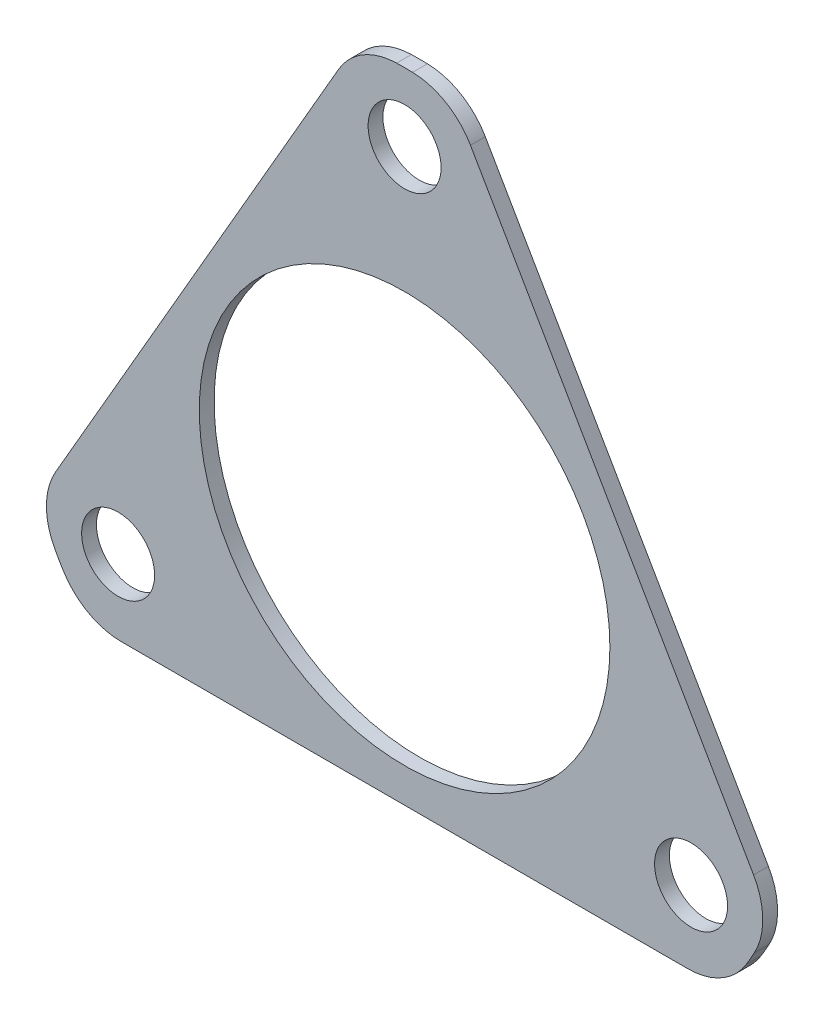
from build123d import *

# Parameters (mm, degrees)
SKETCH2_R           = 18
BOSS_EXTRUDE1_DEPTH = 1.3
BOSS_EXTRUDE7_START = -1.3
BOSS_EXTRUDE7_DEPTH = 1.3
SKETCH17_R          = 0.7
BOSS_EXTRUDE9_DEPTH = 1.3
BOSS_EXTRUDE2_START = -1.3
SKETCH3_R           = 35
SKETCH3_R_2         = 18
BOSS_EXTRUDE2_DEPTH = 1.3
SKETCH6_R           = 5
BOSS_EXTRUDE4_DEPTH = 1
SKETCH7_R           = 59.131365533
CUT_EXTRUDE1_DEPTH  = 10
FILLET1_R           = 6
SKETCH4_R           = 3.2
CUT_EXTRUDE2_DEPTH  = 10
SKETCH18_R          = 18
CUT_EXTRUDE3_DEPTH  = 10


with BuildPart() as part:
    # Sketch2 → Boss-Extrude1 (new body)
    with BuildSketch(Plane.XY.offset(10)):
        Circle(SKETCH2_R)
        with BuildLine():
            ThreePointArc((0, 0.538550206), (0.166421166, 0.512191682), (0.316551869, 0.435696269))
            Line((0.316551869, 0.435696269), (9.992349289, 13.753288904))
            ThreePointArc((9.992349289, 13.753288904), (13.753288904, 9.992349289), (16.167960777, 5.253288904))
            Line((16.167960777, 5.253288904), (0.512191682, 0.166421166))
            ThreePointArc((0.512191682, 0.166421166), (0.538550206, 0), (0.512191682, -0.166421166))
            Line((0.512191682, -0.166421166), (16.167960777, -5.253288904))
            ThreePointArc((16.167960777, -5.253288904), (13.753288904, -9.992349289), (9.992349289, -13.753288904))
            Line((9.992349289, -13.753288904), (0.316551869, -0.435696269))
            ThreePointArc((0.316551869, -0.435696269), (0.166421166, -0.512191682), (0, -0.538550206))
            Line((0, -0.538550206), (0, -17))
            ThreePointArc((0, -17), (-5.253288904, -16.167960777), (-9.992349289, -13.753288904))
            Line((-9.992349289, -13.753288904), (-0.316551869, -0.435696269))
            ThreePointArc((-0.316551869, -0.435696269), (-0.435696269, -0.316551869), (-0.512191682, -0.166421166))
            Line((-0.512191682, -0.166421166), (-16.167960777, -5.253288904))
            ThreePointArc((-16.167960777, -5.253288904), (-17, 0), (-16.167960777, 5.253288904))
            Line((-16.167960777, 5.253288904), (-0.512191682, 0.166421166))
            ThreePointArc((-0.512191682, 0.166421166), (-0.435696269, 0.316551869), (-0.316551869, 0.435696269))
            Line((-0.316551869, 0.435696269), (-9.992349289, 13.753288904))
            ThreePointArc((-9.992349289, 13.753288904), (-5.253288904, 16.167960777), (0, 17))
            Line((0, 17), (0, 0.538550206))
        make_face(mode=Mode.SUBTRACT)
        with BuildLine():
            Line((0.5, 1.198581445), (0.5, 16.492422502))
            ThreePointArc((0.5, 16.492422502), (5.193820321, 15.661233364), (9.454148381, 13.522909391))
            Line((9.454148381, 13.522909391), (0.5, 1.198581445))
        make_face(mode=Mode.SUBTRACT)
        with BuildLine():
            Line((-9.939558578, 13.170238239), (-0.985410197, 0.845910294))
            Line((-0.985410197, 0.845910294), (-15.530717393, 5.57196709))
            ThreePointArc((-15.530717393, 5.57196709), (-13.289739299, 9.779203923), (-9.939558578, 13.170238239))
        make_face(mode=Mode.SUBTRACT)
        with BuildLine():
            Line((-15.597133416, -5.383254519), (-1.109016994, -0.675780132))
            Line((-1.109016994, -0.675780132), (-10.098511219, -13.048757457))
            ThreePointArc((-10.098511219, -13.048757457), (-13.40733091, -9.617352956), (-15.597133416, -5.383254519))
        make_face(mode=Mode.SUBTRACT)
        with BuildLine():
            ThreePointArc((9.289494224, -13.636542709), (5.003553098, -15.723054932), (0.3, -16.497272502))
            Line((0.3, -16.497272502), (0.3, -1.263565384))
            Line((0.3, -1.263565384), (9.289494224, -13.636542709))
        make_face(mode=Mode.SUBTRACT)
        with BuildLine():
            Line((15.782543612, -4.812620609), (1.294427191, -0.105146222))
            Line((1.294427191, -0.105146222), (15.839734388, 4.620910574))
            ThreePointArc((15.839734388, 4.620910574), (16.499696789, -0.100029399), (15.782543612, -4.812620609))
        make_face(mode=Mode.SUBTRACT)
    extrude(amount=-BOSS_EXTRUDE1_DEPTH)

    # Sketch11 → Boss-Extrude7 (add)
    with BuildSketch(Plane(origin=(0, 0, 8.7), x_dir=(-1, 0, 0), z_dir=(0, 0, -1)).offset(BOSS_EXTRUDE7_START)):
        with BuildLine():
            ThreePointArc((-0.512191682, 0.166421166), (-0.435696269, 0.316551869), (-0.316551869, 0.435696269))
            Line((-0.316551869, 0.435696269), (-9.992349289, 13.753288904))
            ThreePointArc((-9.992349289, 13.753288904), (-13.753288904, 9.992349289), (-16.167960777, 5.253288904))
            Line((-16.167960777, 5.253288904), (-0.512191682, 0.166421166))
        make_face()
        with BuildLine():
            Line((0, 17), (0, 0.538550206))
            ThreePointArc((0, 0.538550206), (0.166421166, 0.512191682), (0.316551869, 0.435696269))
            Line((0.316551869, 0.435696269), (9.992349289, 13.753288904))
            ThreePointArc((9.992349289, 13.753288904), (5.253288904, 16.167960777), (0, 17))
        make_face()
        with BuildLine():
            Line((16.167960777, 5.253288904), (0.512191682, 0.166421166))
            ThreePointArc((0.512191682, 0.166421166), (0.531919759, 0.084247813), (0.538550206, 0))
            ThreePointArc((0.538550206, 0), (0.531919759, -0.084247813), (0.512191682, -0.166421166))
            Line((0.512191682, -0.166421166), (16.167960777, -5.253288904))
            ThreePointArc((16.167960777, -5.253288904), (17, 0), (16.167960777, 5.253288904))
        make_face()
        with BuildLine():
            Line((9.992349289, -13.753288904), (0.316551869, -0.435696269))
            ThreePointArc((0.316551869, -0.435696269), (0.166421166, -0.512191682), (0, -0.538550206))
            Line((0, -0.538550206), (0, -17))
            ThreePointArc((0, -17), (5.253288904, -16.167960777), (9.992349289, -13.753288904))
        make_face()
        with BuildLine():
            ThreePointArc((-0.316551869, -0.435696269), (-0.435696269, -0.316551869), (-0.512191682, -0.166421166))
            Line((-0.512191682, -0.166421166), (-16.167960777, -5.253288904))
            ThreePointArc((-16.167960777, -5.253288904), (-13.753288904, -9.992349289), (-9.992349289, -13.753288904))
            Line((-9.992349289, -13.753288904), (-0.316551869, -0.435696269))
        make_face()
        with BuildLine():
            ThreePointArc((0.316551869, 0.435696269), (0.166421166, 0.512191682), (0, 0.538550206))
            ThreePointArc((0, 0.538550206), (-0.166421166, 0.512191682), (-0.316551869, 0.435696269))
            ThreePointArc((-0.316551869, 0.435696269), (-0.435696269, 0.316551869), (-0.512191682, 0.166421166))
            ThreePointArc((-0.512191682, 0.166421166), (-0.538550206, 0), (-0.512191682, -0.166421166))
            ThreePointArc((-0.512191682, -0.166421166), (-0.435696269, -0.316551869), (-0.316551869, -0.435696269))
            ThreePointArc((-0.316551869, -0.435696269), (-0.166421166, -0.512191682), (0, -0.538550206))
            ThreePointArc((0, -0.538550206), (0.166421166, -0.512191682), (0.316551869, -0.435696269))
            ThreePointArc((0.316551869, -0.435696269), (0.435696269, -0.316551869), (0.512191682, -0.166421166))
            ThreePointArc((0.512191682, -0.166421166), (0.531919759, -0.084247813), (0.538550206, 0))
            ThreePointArc((0.538550206, 0), (0.531919759, 0.084247813), (0.512191682, 0.166421166))
            ThreePointArc((0.512191682, 0.166421166), (0.435696269, 0.316551869), (0.316551869, 0.435696269))
        make_face()
    extrude(amount=BOSS_EXTRUDE7_DEPTH)

    # Sketch17 → Boss-Extrude9 (add)
    with BuildSketch(Plane(origin=(0, 0, 8.7), x_dir=(-1, 0, 0), z_dir=(0, 0, -1))):
        Circle(SKETCH17_R)
    extrude(amount=-BOSS_EXTRUDE9_DEPTH)

    # Sketch3 → Boss-Extrude2 (add)
    with BuildSketch(Plane(origin=(0, 0, 8.7), x_dir=(-1, 0, 0), z_dir=(0, 0, -1)).offset(BOSS_EXTRUDE2_START)):
        Circle(SKETCH3_R)
        Circle(SKETCH3_R_2, mode=Mode.SUBTRACT)
    extrude(amount=BOSS_EXTRUDE2_DEPTH)

    # Sketch6 → Boss-Extrude4 (add)
    with BuildSketch(Plane(origin=(0, 0, 10), x_dir=(-1, 0, 0), z_dir=(0, 0, -1))):
        with Locations((0, 30)):
            Circle(SKETCH6_R)
        with Locations((25.980762114, -15)):
            Circle(SKETCH6_R)
        with Locations((-25.980762114, -15)):
            Circle(SKETCH6_R)
    extrude(amount=BOSS_EXTRUDE4_DEPTH)

    # Sketch7 → Cut-Extrude1 (cut)
    with BuildSketch(Plane(origin=(0, 0, 8.7), x_dir=(-1, 0, 0), z_dir=(0, 0, -1))):
        Circle(SKETCH7_R)
        Polygon((0, 42), (-36.373066959, -21), (36.373066959, -21), align=None, mode=Mode.SUBTRACT)
    extrude(amount=-CUT_EXTRUDE1_DEPTH, mode=Mode.SUBTRACT)

    # Fillet1
    fillet1_edges = [part.edges().sort_by_distance(p)[0] for p in [
        (4.186533479, 34.748711306, 9.35),
        (32.186533479, -13.748711306, 9.35),
        (28, -21, 9.35),
        (-28, -21, 9.35),
        (-32.186533479, -13.748711306, 9.35),
        (-4.186533479, 34.748711306, 9.35),
    ]]
    fillet(fillet1_edges, radius=FILLET1_R)

    # Sketch4 → Cut-Extrude2 (cut)
    with BuildSketch(Plane(origin=(0, 0, 8.7), x_dir=(-1, 0, 0), z_dir=(0, 0, -1))):
        with Locations((0, 29)):
            Circle(SKETCH4_R)
        with Locations((25.11473671, -14.5)):
            Circle(SKETCH4_R)
        with Locations((-25.11473671, -14.5)):
            Circle(SKETCH4_R)
    extrude(amount=-CUT_EXTRUDE2_DEPTH, mode=Mode.SUBTRACT)

    # Sketch18 → Cut-Extrude3 (cut)
    with BuildSketch(Plane.XY.offset(10)):
        Circle(SKETCH18_R)
    extrude(amount=-CUT_EXTRUDE3_DEPTH, mode=Mode.SUBTRACT)


solid = part.part
